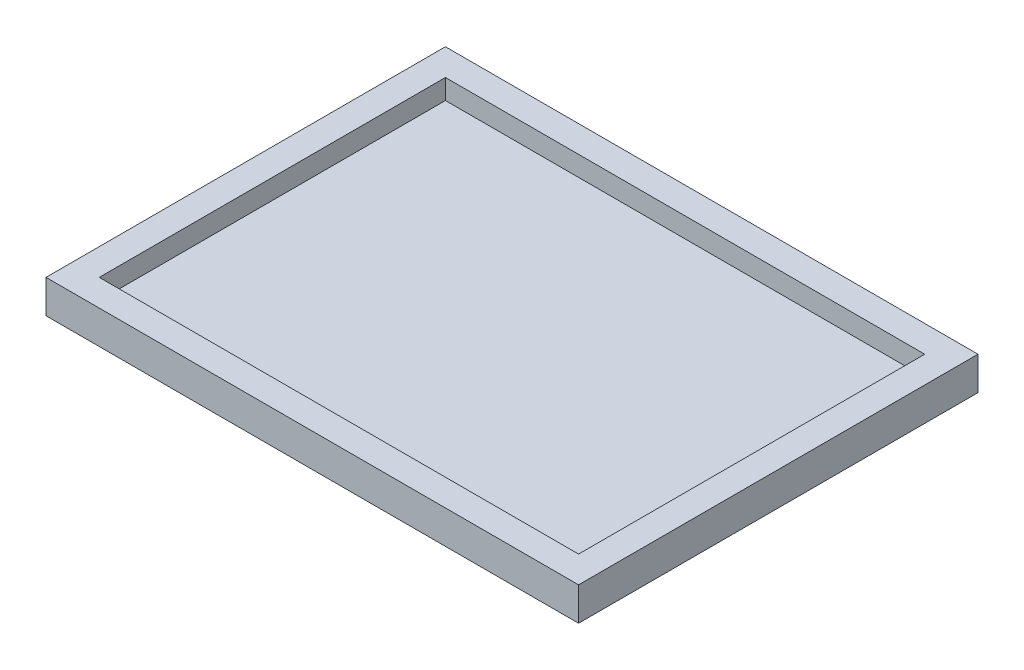
from build123d import *

# Parameters (mm, degrees)
SKETCH1_W           = 400
SKETCH1_H           = 300
BOSS_EXTRUDE1_DEPTH = 10
SKETCH2_W           = 400
SKETCH2_H           = 300
SKETCH2_W_2         = 360
SKETCH2_H_2         = 260
BOSS_EXTRUDE2_DEPTH = 15


with BuildPart() as part:
    # Sketch1 → Boss-Extrude1 (new body)
    with BuildSketch(Plane(origin=(0, 0, 0), x_dir=(1, 0, 0), z_dir=(0, 1, 0))):
        with Locations((200, 150)):
            Rectangle(SKETCH1_W, SKETCH1_H)
    extrude(amount=BOSS_EXTRUDE1_DEPTH)

    # Sketch2 → Boss-Extrude2 (add)
    with BuildSketch(Plane(origin=(0, 10, 0), x_dir=(1, 0, 0), z_dir=(0, 1, 0))):
        with Locations((200, 150)):
            Rectangle(SKETCH2_W, SKETCH2_H)
        with Locations((200, 150)):
            Rectangle(SKETCH2_W_2, SKETCH2_H_2, mode=Mode.SUBTRACT)
    extrude(amount=BOSS_EXTRUDE2_DEPTH)


solid = part.part
